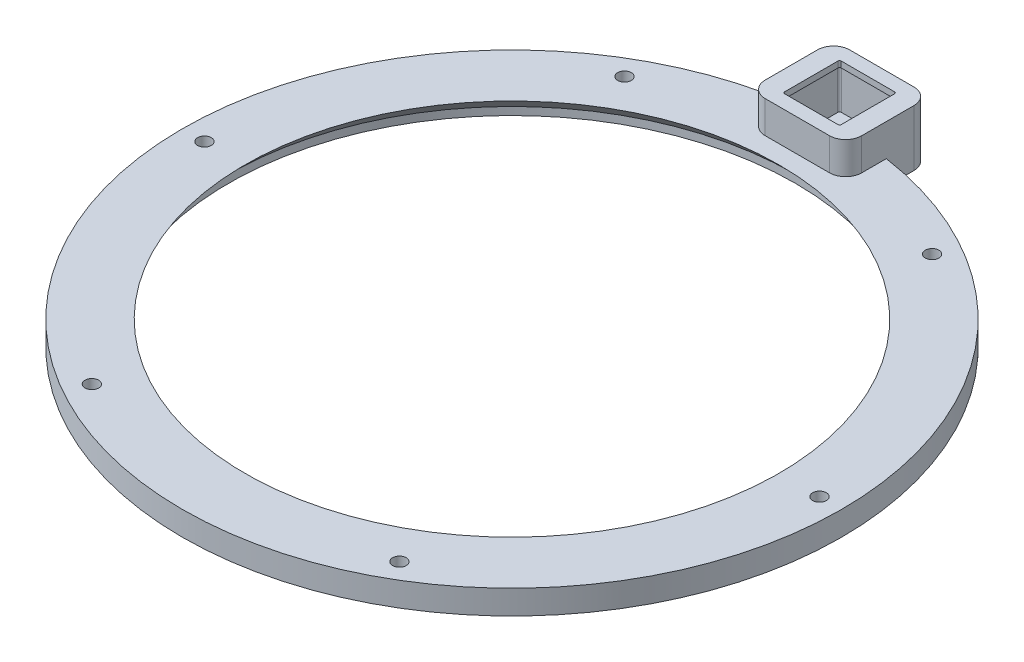
from build123d import *

# Parameters (mm, degrees)
MX_START           = 53
MX_POD_DEPTH       = 14
MX_START_2         = 65.5
MX_CUTOUT_DEPTH    = 1.7
MX_START_3         = 55
MX_RELIEF_DEPTH    = 10.5
MX_START_4         = 52.8
SKETCH5_R          = 3.5
MX_LEAD_HOLE_DEPTH = 2.4
BOLT_START         = 52.8
SKETCH6_R          = 1.7
BOLT_HOLES_DEPTH   = 6.4


with BuildPart() as part:
    # Sketch1 → Lip ring (revolve)
    with BuildSketch(Plane.XY, mode=Mode.PRIVATE) as lip_ring_sk:
        Polygon((70.5, 53), (82, 53), (82, 59), (66.45, 59), (70.5, 54.95), align=None)
    revolve(lip_ring_sk.sketch.rotate(Axis((0, 40, 0), (0, 1, 0)), 90), axis=Axis((0, 40, 0), (0, 1, 0)))

    # Sketch2 → MX pod (add)
    with BuildSketch(Plane(origin=(0, 0, 0), x_dir=(1, 0, 0), z_dir=(0, 1, 0)).offset(MX_START)):
        with BuildLine():
            Line((-8, 92), (8, 92))
            ThreePointArc((8, 92), (10.828427125, 90.828427125), (12, 88))
            Line((12, 88), (12, 75))
            ThreePointArc((12, 75), (10.828427125, 72.171572875), (8, 71))
            Line((8, 71), (-8, 71))
            ThreePointArc((-8, 71), (-10.828427125, 72.171572875), (-12, 75))
            Line((-12, 75), (-12, 88))
            ThreePointArc((-12, 88), (-10.828427125, 90.828427125), (-8, 92))
        make_face()
    extrude(amount=MX_POD_DEPTH)

    # Sketch3 → MX cutout (cut)
    with BuildSketch(Plane(origin=(0, 0, 0), x_dir=(1, 0, 0), z_dir=(0, 1, 0)).offset(MX_START_2)):
        with BuildLine():
            Line((-6.65, 88.55), (6.65, 88.55))
            ThreePointArc((6.65, 88.55), (6.932842712, 88.432842712), (7.05, 88.15))
            Line((7.05, 88.15), (7.05, 74.85))
            ThreePointArc((7.05, 74.85), (6.932842712, 74.567157288), (6.65, 74.45))
            Line((6.65, 74.45), (-6.65, 74.45))
            ThreePointArc((-6.65, 74.45), (-6.932842712, 74.567157288), (-7.05, 74.85))
            Line((-7.05, 74.85), (-7.05, 88.15))
            ThreePointArc((-7.05, 88.15), (-6.932842712, 88.432842712), (-6.65, 88.55))
        make_face()
    extrude(amount=MX_CUTOUT_DEPTH, mode=Mode.SUBTRACT)

    # Sketch4 → MX relief (cut)
    with BuildSketch(Plane(origin=(0, 0, 0), x_dir=(1, 0, 0), z_dir=(0, 1, 0)).offset(MX_START_3)):
        with BuildLine():
            Line((-7.5, 89.5), (7.5, 89.5))
            ThreePointArc((7.5, 89.5), (7.853553391, 89.353553391), (8, 89))
            Line((8, 89), (8, 74))
            ThreePointArc((8, 74), (7.853553391, 73.646446609), (7.5, 73.5))
            Line((7.5, 73.5), (-7.5, 73.5))
            ThreePointArc((-7.5, 73.5), (-7.853553391, 73.646446609), (-8, 74))
            Line((-8, 74), (-8, 89))
            ThreePointArc((-8, 89), (-7.853553391, 89.353553391), (-7.5, 89.5))
        make_face()
    extrude(amount=MX_RELIEF_DEPTH, mode=Mode.SUBTRACT)

    # Sketch5 → MX lead hole (cut)
    with BuildSketch(Plane(origin=(0, 0, 0), x_dir=(1, 0, 0), z_dir=(0, 1, 0)).offset(MX_START_4)):
        with Locations(Location((0, 76.5, 0), (0, 0, 90))):
            Circle(SKETCH5_R)
    extrude(amount=MX_LEAD_HOLE_DEPTH, mode=Mode.SUBTRACT)

    # Sketch6 → Bolt holes (cut)
    with BuildSketch(Plane(origin=(0, 0, 0), x_dir=(1, 0, 0), z_dir=(0, 1, 0)).offset(BOLT_START)):
        with Locations(Location((76.5, 0, 0), (0, 0, 90))):
            Circle(SKETCH6_R)
        with Locations(Location((38.25, -66.25094339, 0), (0, 0, 90))):
            Circle(SKETCH6_R)
        with Locations(Location((-38.25, -66.25094339, 0), (0, 0, 90))):
            Circle(SKETCH6_R)
        with Locations(Location((-76.5, 0, 0), (0, 0, 90))):
            Circle(SKETCH6_R)
        with Locations(Location((-38.25, 66.25094339, 0), (0, 0, 90))):
            Circle(SKETCH6_R)
        with Locations(Location((38.25, 66.25094339, 0), (0, 0, 90))):
            Circle(SKETCH6_R)
    extrude(amount=BOLT_HOLES_DEPTH, mode=Mode.SUBTRACT)


solid = part.part
